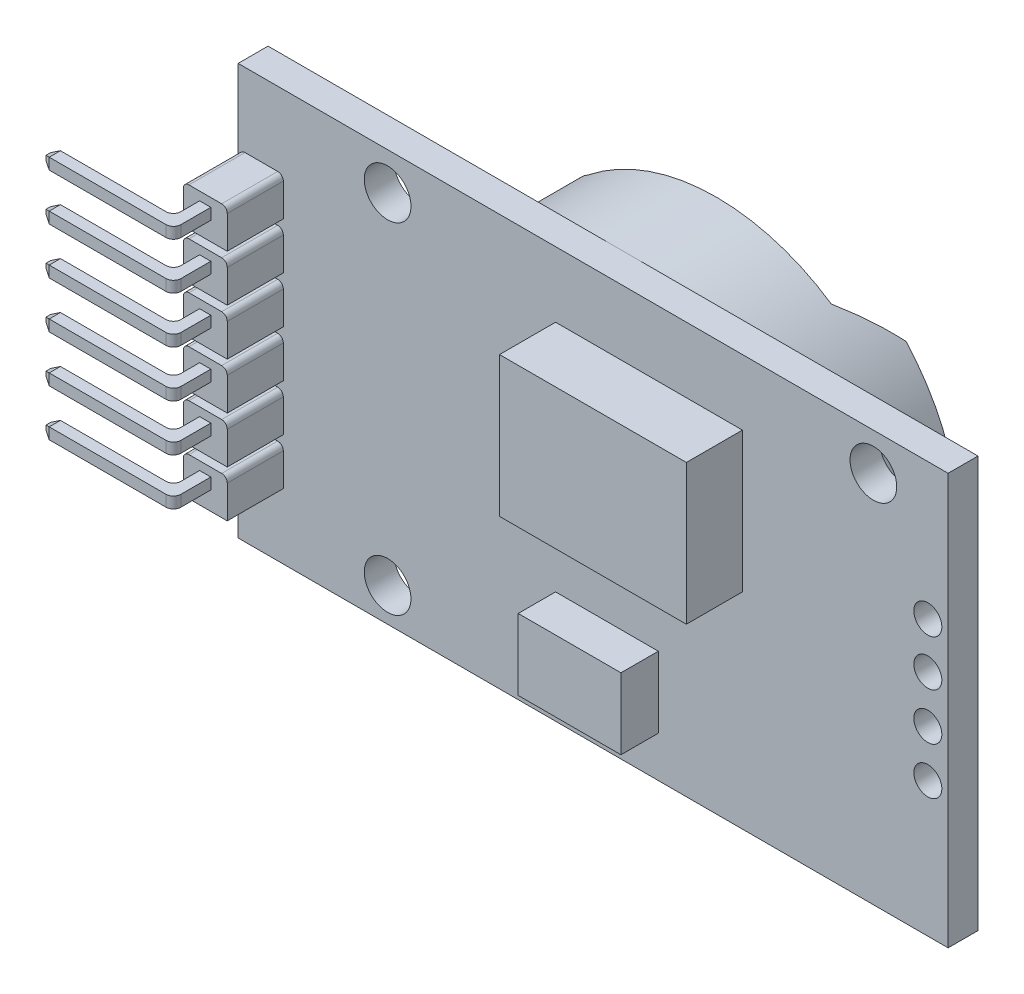
from build123d import *

# Parameters (mm, degrees)
SKETCH1_W              = 38
SKETCH1_H              = 22
BOSS_EXTRUDE1_DEPTH    = 1.6
BOSS_EXTRUDE2_DEPTH    = 3
SKETCH3_W              = 0.6
SKETCH3_H              = 0.6
BOSS_EXTRUDE3_DEPTH    = 3.5
SKETCH4_W              = 6.4
SKETCH4_H              = 0.6
BOSS_EXTRUDE4_DEPTH    = 0.6
FILLET1_R              = 0.4
CUT_EXTRUDE1_DEPTH     = 0.6
CUT_EXTRUDE2_DEPTH     = 0.6
LPATTERN1_COUNT        = 6
LPATTERN1_PITCH        = 2.5
FILLET1_OF_LPATTERN1_R = 0.4
SKETCH2_3_R            = 1.25
CUT_EXTRUDE3_DEPTH     = 9.6
SKETCH2_4_W            = 10
SKETCH2_4_H            = 7.5
BOSS_EXTRUDE5_DEPTH    = 3
SKETCH2_5_W            = 5.5
SKETCH2_5_H            = 3.8
BOSS_EXTRUDE6_DEPTH    = 2
SKETCH2_6_R            = 0.75
CUT_EXTRUDE4_DEPTH     = 4
SKETCH8_R              = 11
SKETCH8_R_2            = 10
BOSS_EXTRUDE7_DEPTH    = 7
CUT_EXTRUDE5_DEPTH     = 34.636111991
BOSS_EXTRUDE8_START    = -7
BOSS_EXTRUDE8_DEPTH    = 7
SKETCH11_W             = 2.618061064
SKETCH11_H             = 5.013750937
CUT_EXTRUDE6_DEPTH     = 7
SKETCH12_R             = 9.75
BOSS_EXTRUDE9_DEPTH    = 6
FILLET2_R              = 0.52


with BuildPart() as part:
    # Sketch1 → Boss-Extrude1 (new body)
    with BuildSketch(Plane.XY):
        Rectangle(SKETCH1_W, SKETCH1_H)
    extrude(amount=BOSS_EXTRUDE1_DEPTH)

    # Sketch2 → Boss-Extrude2 (add)
    with BuildSketch(Plane.XY.offset(1.6)):
        with BuildLine():
            Line((-18.93212299, -5.75), (-18.93212299, -7.5))
            Line((-18.93212299, -7.5), (-16.58212299, -7.5))
            Line((-16.58212299, -7.5), (-16.58212299, -5.75))
            ThreePointArc((-16.58212299, -5.75), (-16.669990956, -5.537867966), (-16.88212299, -5.45))
            Line((-16.88212299, -5.45), (-18.63212299, -5.45))
            ThreePointArc((-18.63212299, -5.45), (-18.844255025, -5.537867966), (-18.93212299, -5.75))
        make_face()
        with BuildLine():
            ThreePointArc((-18.93212299, -5), (-18.932119346, -5.001478794), (-18.932108411, -5.002957552))
            Line((-18.932108411, -5.002957552), (-16.582137569, -5.002957552))
            ThreePointArc((-16.582137569, -5.002957552), (-16.582126635, -5.001478794), (-16.58212299, -5))
            Line((-16.58212299, -5), (-16.58212299, -3.25))
            ThreePointArc((-16.58212299, -3.25), (-16.669990956, -3.037867966), (-16.88212299, -2.95))
            Line((-16.88212299, -2.95), (-18.63212299, -2.95))
            ThreePointArc((-18.63212299, -2.95), (-18.844255025, -3.037867966), (-18.93212299, -3.25))
            Line((-18.93212299, -3.25), (-18.93212299, -5))
        make_face()
        with BuildLine():
            ThreePointArc((-18.93212299, -2.5), (-18.932119346, -2.501478794), (-18.932108411, -2.502957552))
            Line((-18.932108411, -2.502957552), (-16.582137569, -2.502957552))
            ThreePointArc((-16.582137569, -2.502957552), (-16.582126635, -2.501478794), (-16.58212299, -2.5))
            Line((-16.58212299, -2.5), (-16.58212299, -0.75))
            ThreePointArc((-16.58212299, -0.75), (-16.669990956, -0.537867966), (-16.88212299, -0.45))
            Line((-16.88212299, -0.45), (-18.63212299, -0.45))
            ThreePointArc((-18.63212299, -0.45), (-18.844255025, -0.537867966), (-18.93212299, -0.75))
            Line((-18.93212299, -0.75), (-18.93212299, -2.5))
        make_face()
        with BuildLine():
            ThreePointArc((-18.93212299, 0), (-18.932119346, -0.001478794), (-18.932108411, -0.002957552))
            Line((-18.932108411, -0.002957552), (-16.582137569, -0.002957552))
            ThreePointArc((-16.582137569, -0.002957552), (-16.582126635, -0.001478794), (-16.58212299, 0))
            Line((-16.58212299, 0), (-16.58212299, 1.75))
            ThreePointArc((-16.58212299, 1.75), (-16.669990956, 1.962132034), (-16.88212299, 2.05))
            Line((-16.88212299, 2.05), (-18.63212299, 2.05))
            ThreePointArc((-18.63212299, 2.05), (-18.844255025, 1.962132034), (-18.93212299, 1.75))
            Line((-18.93212299, 1.75), (-18.93212299, 0))
        make_face()
        with BuildLine():
            ThreePointArc((-18.93212299, 2.5), (-18.932119346, 2.498521206), (-18.932108411, 2.497042448))
            Line((-18.932108411, 2.497042448), (-16.582137569, 2.497042448))
            ThreePointArc((-16.582137569, 2.497042448), (-16.582126635, 2.498521206), (-16.58212299, 2.5))
            Line((-16.58212299, 2.5), (-16.58212299, 4.25))
            ThreePointArc((-16.58212299, 4.25), (-16.669990956, 4.462132034), (-16.88212299, 4.55))
            Line((-16.88212299, 4.55), (-18.63212299, 4.55))
            ThreePointArc((-18.63212299, 4.55), (-18.844255025, 4.462132034), (-18.93212299, 4.25))
            Line((-18.93212299, 4.25), (-18.93212299, 2.5))
        make_face()
        with BuildLine():
            Line((-18.93212299, 6.75), (-18.93212299, 5))
            Line((-18.93212299, 5), (-16.58212299, 5))
            Line((-16.58212299, 5), (-16.58212299, 6.75))
            ThreePointArc((-16.58212299, 6.75), (-16.669990956, 6.962132034), (-16.88212299, 7.05))
            Line((-16.88212299, 7.05), (-18.63212299, 7.05))
            ThreePointArc((-18.63212299, 7.05), (-18.844255025, 6.962132034), (-18.93212299, 6.75))
        make_face()
    extrude(amount=BOSS_EXTRUDE2_DEPTH)

    # Sketch3 → Boss-Extrude3 (add, symmetric)
    with BuildSketch(Plane.XY.offset(3.1)):
        with Locations((-17.761971095, -6.203840363)):
            Rectangle(SKETCH3_W, SKETCH3_H)
    boss_extrude3 = extrude(amount=BOSS_EXTRUDE3_DEPTH, both=True)

    # Sketch4 → Boss-Extrude4 (add)
    with BuildSketch(Plane.XZ.offset(6.503840363)):
        with Locations((-21.261971095, 6.3)):
            Rectangle(SKETCH4_W, SKETCH4_H)
    boss_extrude4 = extrude(amount=-BOSS_EXTRUDE4_DEPTH)

    # Fillet1
    fillet1_edges = [part.edges().sort_by_distance(p)[0] for p in [
        (-17.461971095, -6.203840363, 6.6),
        (-18.061971095, -6.203840363, 6),
    ]]
    fillet(fillet1_edges, radius=FILLET1_R)

    # Sketch5 → Cut-Extrude1 (cut)
    with BuildSketch(Plane.XZ.offset(6.503840363)):
        Polygon((-24.461971095, 6.6), (-24.461971095, 6.421666093), (-24.111971095, 6.6), align=None)
        Polygon((-24.111971095, 6), (-24.461971095, 6.178333907), (-24.461971095, 6), align=None)
    cut_extrude1 = extrude(amount=-CUT_EXTRUDE1_DEPTH, mode=Mode.SUBTRACT)

    # Sketch6 → Cut-Extrude2 (cut)
    with BuildSketch(Plane.XY.offset(6.6)):
        Polygon((-24.461971095, -6.08217427), (-24.111971095, -5.903840363), (-24.461971095, -5.903840363), align=None)
        Polygon((-24.461971095, -6.503840363), (-24.111971095, -6.503840363), (-24.461971095, -6.325506456), align=None)
    cut_extrude2 = extrude(amount=-CUT_EXTRUDE2_DEPTH, mode=Mode.SUBTRACT)

    # LPattern1: Boss-Extrude3, Boss-Extrude4, Cut-Extrude1, Cut-Extrude2 ×6
    with Locations(*[(0, i * LPATTERN1_PITCH, 0) for i in range(1, LPATTERN1_COUNT)]):
        add(boss_extrude3)
        add(boss_extrude4)
        add(cut_extrude1, mode=Mode.SUBTRACT)
        add(cut_extrude2, mode=Mode.SUBTRACT)

    # Fillet1 of LPattern1
    fillet1_of_lpattern1_edges = [part.edges().sort_by_distance(p)[0] for p in [
        (-17.461971095, -3.703840363, 6.6),
        (-18.061971095, -3.703840363, 6),
        (-17.461971095, -1.203840363, 6.6),
        (-18.061971095, -1.203840363, 6),
        (-17.461971095, 1.296159637, 6.6),
        (-18.061971095, 1.296159637, 6),
        (-17.461971095, 3.796159637, 6.6),
        (-18.061971095, 3.796159637, 6),
        (-17.461971095, 6.296159637, 6.6),
        (-18.061971095, 6.296159637, 6),
    ]]
    fillet(fillet1_of_lpattern1_edges, radius=FILLET1_OF_LPATTERN1_R)

    # Sketch2<3> → Cut-Extrude3 (cut)
    with BuildSketch(Plane.XY.offset(1.6)):
        with Locations((-11, -9.197051961)):
            Circle(SKETCH2_3_R)
        with Locations((15, 9)):
            Circle(SKETCH2_3_R)
        with Locations((-11, 9)):
            Circle(SKETCH2_3_R)
    extrude(amount=-CUT_EXTRUDE3_DEPTH, mode=Mode.SUBTRACT)

    # Sketch2<4> → Boss-Extrude5 (add)
    with BuildSketch(Plane.XY.offset(1.6)):
        with Locations((2.99007, 3.747042448)):
            Rectangle(SKETCH2_4_W, SKETCH2_4_H)
    extrude(amount=BOSS_EXTRUDE5_DEPTH)

    # Sketch2<5> → Boss-Extrude6 (add)
    with BuildSketch(Plane.XY.offset(1.6)):
        with Locations((0.74007, -6.902957552)):
            Rectangle(SKETCH2_5_W, SKETCH2_5_H)
    extrude(amount=BOSS_EXTRUDE6_DEPTH)

    # Sketch2<6> → Cut-Extrude4 (cut)
    with BuildSketch(Plane.XY.offset(1.6)):
        with Locations((17.914118727, 3.707734893)):
            Circle(SKETCH2_6_R)
        with Locations((17.914118727, 1.24297087)):
            Circle(SKETCH2_6_R)
        with Locations((17.914118727, -1.272678605)):
            Circle(SKETCH2_6_R)
        with Locations((17.914118727, -3.79150842)):
            Circle(SKETCH2_6_R)
    extrude(amount=-CUT_EXTRUDE4_DEPTH, mode=Mode.SUBTRACT)

    # Sketch8 → Boss-Extrude7 (add)
    with BuildSketch(Plane(origin=(0, 0, 0), x_dir=(-1, 0, 0), z_dir=(0, 0, -1))):
        with Locations(Location((0, 0, 0), (0, 0, 270))):
            Circle(SKETCH8_R)
        Circle(SKETCH8_R_2, mode=Mode.SUBTRACT)
    extrude(amount=BOSS_EXTRUDE7_DEPTH)

    # Sketch9 → Cut-Extrude5 (cut, through all)
    with BuildSketch(Plane.XZ.offset(11)):
        Polygon((0, -5), (-6.83281851, -5), (-10.422816868, -7), (8.148806691, -7), (6.148806691, -5), align=None)
    extrude(amount=-CUT_EXTRUDE5_DEPTH, mode=Mode.SUBTRACT)

    # Sketch10 → Boss-Extrude8 (add)
    with BuildSketch(Plane(origin=(0, 0, -7), x_dir=(-1, 0, 0), z_dir=(0, 0, -1)).offset(BOSS_EXTRUDE8_START)):
        with BuildLine():
            Line((13.3, 3.516374346), (10.422816868, 3.516374346))
            ThreePointArc((10.422816868, 3.516374346), (10.577386705, 3.019750071), (10.708307997, 2.516374346))
            Line((10.708307997, 2.516374346), (12.3, 2.516374346))
            Line((12.3, 2.516374346), (12.3, -2.516374346))
            Line((12.3, -2.516374346), (10.708307997, -2.516374346))
            ThreePointArc((10.708307997, -2.516374346), (10.577386705, -3.019750071), (10.422816868, -3.516374346))
            Line((10.422816868, -3.516374346), (13.3, -3.516374346))
            Line((13.3, -3.516374346), (13.3, 3.516374346))
        make_face()
    extrude(amount=BOSS_EXTRUDE8_DEPTH)

    # Sketch11 → Cut-Extrude6 (cut)
    with BuildSketch(Plane(origin=(0, 0, -7), x_dir=(-1, 0, 0), z_dir=(0, 0, -1))):
        with Locations((10.195123466, 0.009498878)):
            Rectangle(SKETCH11_W, SKETCH11_H)
    extrude(amount=-CUT_EXTRUDE6_DEPTH, mode=Mode.SUBTRACT)

    # Sketch12 → Boss-Extrude9 (add)
    with BuildSketch(Plane(origin=(0, 0, 0), x_dir=(-1, 0, 0), z_dir=(0, 0, -1))):
        Circle(SKETCH12_R)
    extrude(amount=BOSS_EXTRUDE9_DEPTH)

    # Fillet2
    fillet2_edges = [part.edges().sort_by_distance(p)[0] for p in [
        (9.75, 0, -6),
    ]]
    fillet(fillet2_edges, radius=FILLET2_R)


solid = part.part
